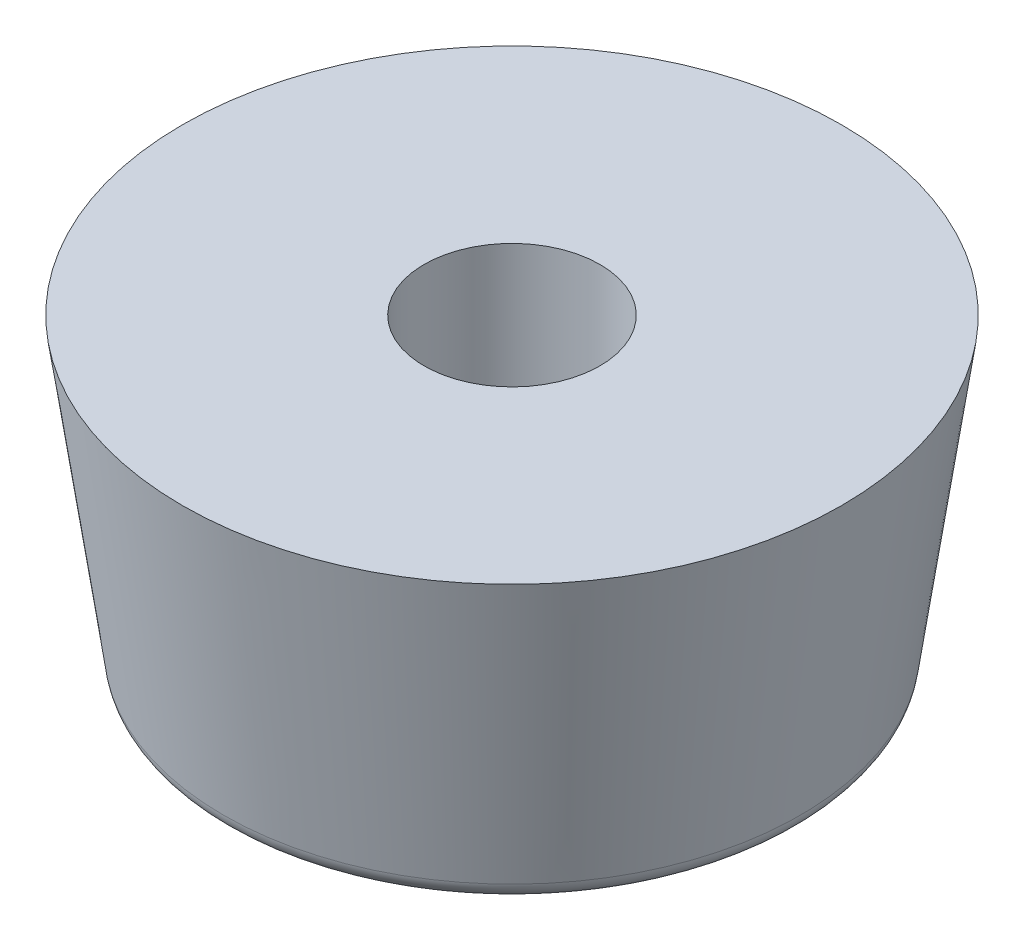
from build123d import *

# Parameters (mm, degrees)
FILLET_2_R = 0.5


with BuildPart() as part:
    # 草图1 → 旋转1 (revolve)
    with BuildSketch(Plane.XY, mode=Mode.PRIVATE) as revolve_1_sk:
        Polygon((2, 7), (7.5, 7), (6.5, 0), (3.5, 0), (3.5, 3.27), (2, 3.27), align=None)
    revolve(revolve_1_sk.sketch.rotate(Axis((0, 0, 0), (0, 1, 0)), 90), axis=Axis((0, 0, 0), (0, 1, 0)))

    # 圆角2
    fillet_2_edges = [part.edges().sort_by_distance(p)[0] for p in [
        (0, 0, 3.5),
        (0, 0, 6.5),
    ]]
    fillet(fillet_2_edges, radius=FILLET_2_R)


solid = part.part
